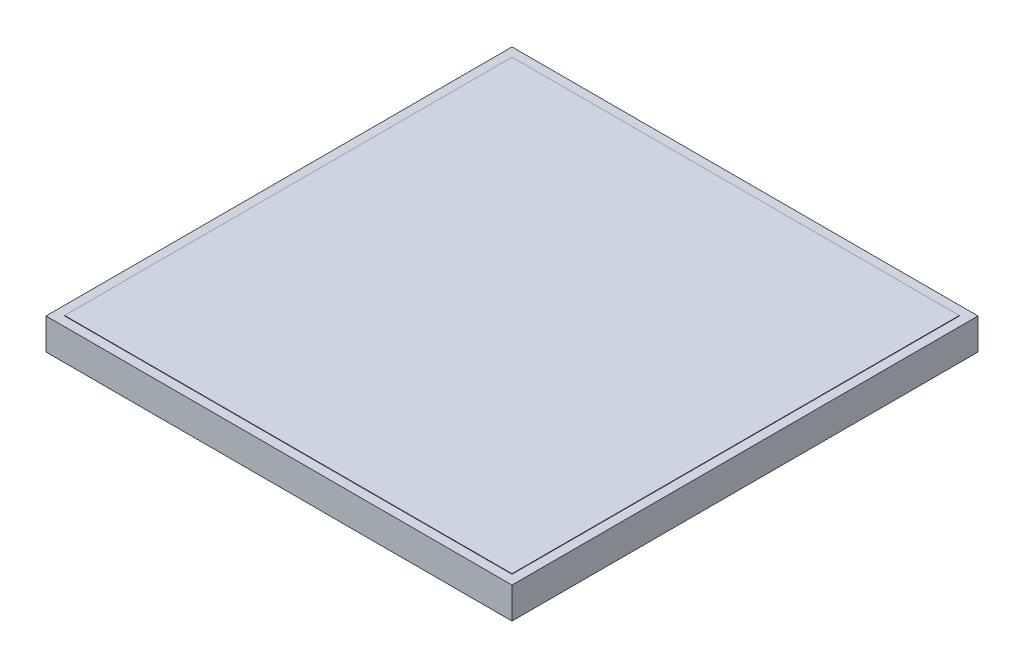
from build123d import *

# Parameters (mm, degrees)
SKETCH1_W           = 10
SKETCH1_H           = 10
BOSS_EXTRUDE1_DEPTH = 0.68
SKETCH2_W           = 10
SKETCH2_H           = 10
SKETCH2_W_2         = 9.6
SKETCH2_H_2         = 9.6
CUT_EXTRUDE1_DEPTH  = 0.01


with BuildPart() as part:
    # Sketch1 → Boss-Extrude1 (new body)
    with BuildSketch(Plane(origin=(0, 0, 0), x_dir=(1, 0, 0), z_dir=(0, 1, 0))):
        Rectangle(SKETCH1_W, SKETCH1_H)
    extrude(amount=BOSS_EXTRUDE1_DEPTH)

    # Sketch2 → Cut-Extrude1 (cut)
    with BuildSketch(Plane(origin=(0, 0.68, 0), x_dir=(1, 0, 0), z_dir=(0, 1, 0))):
        Rectangle(SKETCH2_W, SKETCH2_H)
        Rectangle(SKETCH2_W_2, SKETCH2_H_2, mode=Mode.SUBTRACT)
    extrude(amount=-CUT_EXTRUDE1_DEPTH, mode=Mode.SUBTRACT)


solid = part.part
